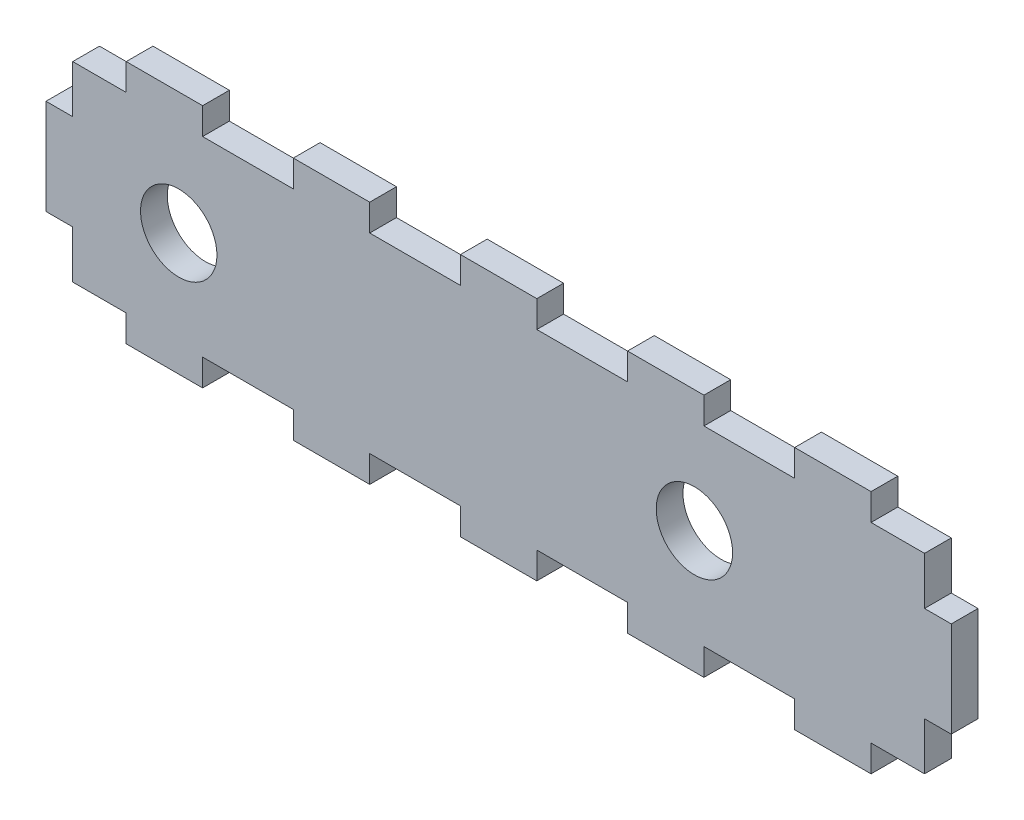
from build123d import *

# Parameters (mm, degrees)
SKETCH_1_R      = 4
EXTRUDE_1_DEPTH = 1.4


with BuildPart() as part:
    # Эскиз1 → Бобышка-Вытянуть1 (new, symmetric)
    with BuildSketch(Plane.XY):
        Polygon((39, -10), (44.6, -10), (44.6, -5), (47.4, -5), (47.4, 5), (44.6, 5), (44.6, 10), (39, 10), (39, 12.8), (31, 12.8), (31, 10), (21.5, 10), (21.5, 12.8), (13.5, 12.8), (13.5, 10), (4, 10), (4, 12.8), (-4, 12.8), (-4, 10), (-13.5, 10), (-13.5, 12.8), (-21.5, 12.8), (-21.5, 10), (-31, 10), (-31, 12.8), (-39, 12.8), (-39, 10), (-44.6, 10), (-44.6, 5), (-47.4, 5), (-47.4, -5), (-44.6, -5), (-44.6, -10), (-39, -10), (-39, -12.8), (-31, -12.8), (-31, -10), (-21.5, -10), (-21.5, -12.8), (-13.5, -12.8), (-13.5, -10), (-4, -10), (-4, -12.8), (4, -12.8), (4, -10), (13.5, -10), (13.5, -12.8), (21.5, -12.8), (21.5, -10), (31, -10), (31, -12.8), (39, -12.8), align=None)
        with Locations((20.5, 0)):
            Circle(SKETCH_1_R, mode=Mode.SUBTRACT)
        with Locations((-33.5, 0)):
            Circle(SKETCH_1_R, mode=Mode.SUBTRACT)
    extrude(amount=EXTRUDE_1_DEPTH, both=True)


solid = part.part
